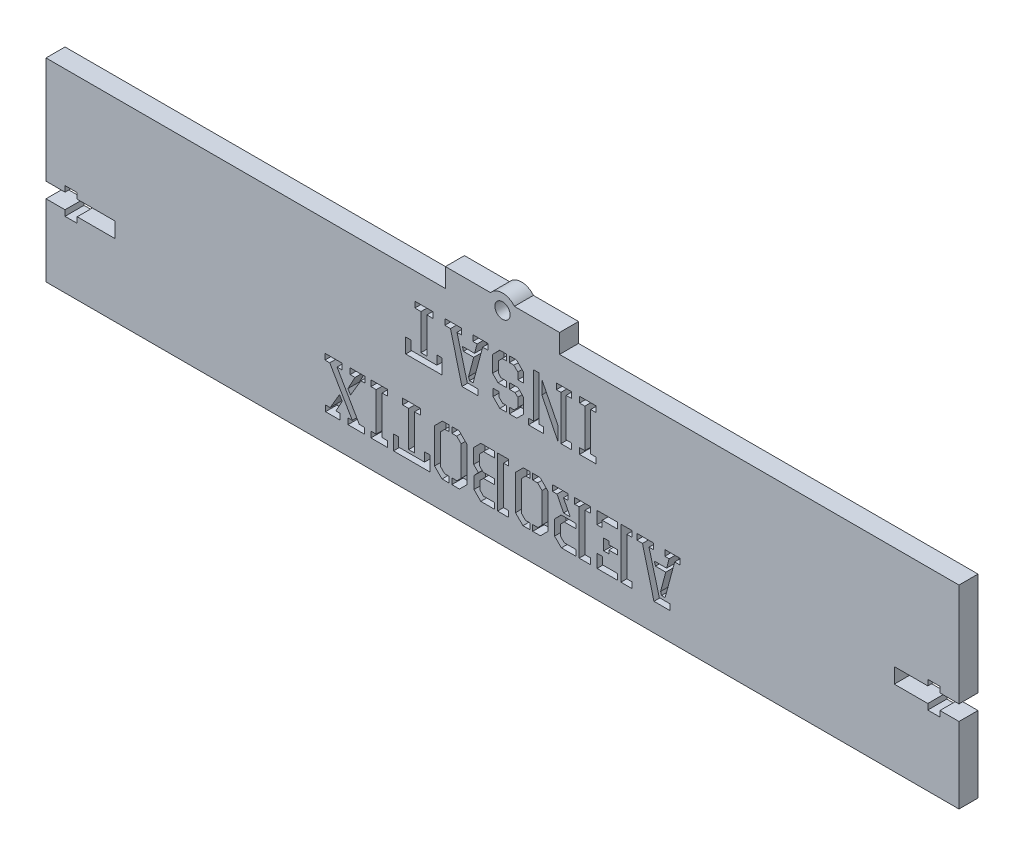
from build123d import *

# Parameters (mm, degrees)
SKETCH1_W           = 240
SKETCH1_H           = 51
BOSS_EXTRUDE1_DEPTH = 5
SKETCH4_W           = 30
SKETCH4_H           = 5
BOSS_EXTRUDE2_DEPTH = 5
SKETCH7_R           = 2
CUT_EXTRUDE2_DEPTH  = 5
SKETCH8_R           = 4
SKETCH8_R_2         = 2
BOSS_EXTRUDE4_DEPTH = 5
CUT_EXTRUDE3_DEPTH  = 3
CUT_EXTRUDE4_DEPTH  = 10
CUT_EXTRUDE5_DEPTH  = 10


with BuildPart() as part:
    # Sketch1 → Boss-Extrude1 (new body)
    with BuildSketch(Plane.XY):
        Rectangle(SKETCH1_W, SKETCH1_H)
    extrude(amount=BOSS_EXTRUDE1_DEPTH)

    # Sketch4 → Boss-Extrude2 (add)
    with BuildSketch(Plane.XY.offset(5)):
        with Locations((0, 28)):
            Rectangle(SKETCH4_W, SKETCH4_H)
    extrude(amount=-BOSS_EXTRUDE2_DEPTH)

    # Sketch7 → Cut-Extrude2 (cut)
    with BuildSketch(Plane.XY.offset(5)):
        with Locations((0, 28)):
            Circle(SKETCH7_R)
    extrude(amount=-CUT_EXTRUDE2_DEPTH, mode=Mode.SUBTRACT)

    # Sketch8 → Boss-Extrude4 (add)
    with BuildSketch(Plane.XY.offset(5)):
        with Locations((0, 28)):
            Circle(SKETCH8_R)
        with Locations((0, 28)):
            Circle(SKETCH8_R_2, mode=Mode.SUBTRACT)
    extrude(amount=-BOSS_EXTRUDE4_DEPTH)

    # Sketch9 → Cut-Extrude3 (cut)
    with BuildSketch(Plane.XY.offset(5)):
        Polygon((-43.493968571, -6.617965842), (-42.175825537, -6.617965842), (-42.175825537, -5.070567123), (-46.676342467, -5.070567123), (-46.676342467, -6.617965842), (-45.414691277, -6.617965842), (-39.483047624, -16.752332411), (-40.612884511, -16.752332411), (-40.612884511, -18.29973379), (-36.263012499, -18.29973379), (-36.263012499, -16.752332411), (-37.637647377, -16.752332411), align=None)
        Polygon((-36.11236758, -6.617965842), (-36.11236758, -5.070567123), (-40.047966068, -5.070567123), (-40.047966068, -6.617965842), (-38.767484263, -6.617965842), (-40.631715125, -10.092278118), (-39.953812994, -11.243983845), (-37.223373852, -6.617965842), align=None)
        Polygon((-46.525697549, -18.29973379), (-42.721913365, -18.29973379), (-42.721913365, -16.752332411), (-43.776427792, -16.752332411), (-42.138164307, -13.758541348), (-42.834897054, -12.549250335), (-45.301707589, -16.752332411), (-46.525697549, -16.752332411), align=None)
        Polygon((-34.578324285, -18.29973379), (-30.281653149, -18.29973379), (-30.281653149, -16.752332411), (-31.656288028, -16.752332411), (-31.656288028, -6.617965842), (-30.281653149, -6.617965842), (-30.281653149, -5.070567123), (-34.578324285, -5.070567123), (-34.578324285, -6.617965842), (-33.203689407, -6.617965842), (-33.203689407, -16.752332411), (-34.578324285, -16.752332411), align=None)
        Polygon((-21.515198519, -6.617965842), (-21.515198519, -5.070567123), (-26.257914189, -5.070567123), (-26.257914189, -6.617965842), (-24.660304932, -6.617965842), (-24.660304932, -15.991270155), (-23.112903553, -15.991270155), (-23.112903553, -6.617965842), align=None)
        Polygon((-28.670462331, -18.298086976), (-19.102743493, -18.298086976), (-19.102743493, -14.410001338), (-20.475790087, -14.410001338), (-20.475790087, -16.753976565), (-27.297415737, -16.753976565), (-27.297415737, -14.410001338), (-28.670462331, -14.410001338), align=None)
        Polygon((-9.338875522, -16.330684138), (-9.338875522, -7.136233419), (-11.400378224, -5.070567123), (-13.32349799, -5.070567123), (-13.32349799, -6.617965842), (-12.047765076, -6.617965842), (-10.886276901, -7.788866664), (-10.886276901, -15.658855798), (-11.971601917, -16.752332411), (-13.32349799, -16.752332411), (-13.32349799, -18.29973379), (-11.305174276, -18.29973379), align=None)
        Polygon((-15.227576966, -16.752332411), (-16.313064269, -15.658855798), (-16.313064269, -7.788866664), (-15.151413807, -6.617965842), (-14.085129581, -6.617965842), (-14.085129581, -5.070567123), (-15.798800659, -5.070567123), (-17.860465649, -7.136233419), (-17.860465649, -16.330684138), (-15.894004608, -18.29973379), (-14.085129581, -18.29973379), (-14.085129581, -16.752332411), align=None)
        Polygon((-5.011321965, -16.752332411), (-5.968682339, -15.763666606), (-5.968682339, -13.689580008), (-5.011321965, -12.720380664), (-2.062652014, -12.720380664), (-2.062652014, -11.34733673), (-5.068763588, -11.34733673), (-6.026131943, -10.377943173), (-6.026131943, -7.66455747), (-5.011321965, -6.617965842), (-2.062652014, -6.617965842), (-2.062652014, -5.070567123), (-5.681474227, -5.070567123), (-7.573533322, -6.966829718), (-7.573533322, -10.823713682), (-6.346263035, -12.088086504), (-7.484506921, -13.30190027), (-7.484506921, -16.500258108), (-5.700621434, -18.29973379), (-2.062652014, -18.29973379), (-2.062652014, -16.752332411), align=None)
        Polygon((1.645475946, -16.752332411), (0.250637664, -16.752332411), (0.250637664, -6.617965842), (1.645475946, -6.617965842), (1.645475946, -5.070567123), (-1.296763715, -5.070567123), (-1.296763715, -18.29973379), (1.645475946, -18.29973379), align=None)
        Polygon((11.932408273, -16.330684138), (11.932408273, -7.136233419), (9.87090557, -5.070567123), (7.947785804, -5.070567123), (7.947785804, -6.617965842), (9.223518718, -6.617965842), (10.385006894, -7.788866664), (10.385006894, -15.658855798), (9.299681877, -16.752332411), (7.947785804, -16.752332411), (7.947785804, -18.29973379), (9.966109519, -18.29973379), align=None)
        Polygon((6.043706828, -16.752332411), (4.958219525, -15.658855798), (4.958219525, -7.788866664), (6.119869987, -6.617965842), (7.186154214, -6.617965842), (7.186154214, -5.070567123), (5.472483136, -5.070567123), (3.410818146, -7.136233419), (3.410818146, -16.330684138), (5.377279187, -18.29973379), (7.186154214, -18.29973379), (7.186154214, -16.752332411), align=None)
        Polygon((23.091114525, -16.752332411), (21.696276244, -16.752332411), (21.696276244, -6.617965842), (23.091114525, -6.617965842), (23.091114525, -5.070567123), (18.971157988, -5.070567123), (18.971157988, -6.617965842), (20.148874865, -6.617965842), (20.148874865, -18.29973379), (23.091114525, -18.29973379), align=None)
        Polygon((16.210280719, -16.752332411), (15.245151852, -15.762966909), (15.245151852, -13.012382894), (16.210280719, -12.022964183), (19.376601503, -12.022964183), (19.376601503, -10.824272375), (15.418700523, -10.824272375), (13.697750473, -12.596827035), (13.697750473, -16.514925129), (15.476621025, -18.29973379), (19.376601503, -18.29973379), (19.376601503, -16.752332411), align=None)
        Polygon((16.017212378, -6.617965842), (17.175622421, -6.617965842), (17.175622421, -5.070567123), (13.151662644, -5.070567123), (13.151662644, -6.617965842), (14.327530514, -6.617965842), (16.055826046, -10.066442557), (17.812747945, -10.066442557), align=None)
        Polygon((34.075465993, -16.752332411), (32.680627712, -16.752332411), (32.680627712, -6.617965842), (34.075465993, -6.617965842), (34.075465993, -5.070567123), (31.133226332, -5.070567123), (31.133226332, -18.283388029), (34.075465993, -18.283388029), align=None)
        Polygon((24.856456726, -18.29973379), (30.239660719, -18.29973379), (30.239660719, -16.752332411), (26.22950332, -16.752332411), (26.22950332, -14.850775535), (24.856456726, -14.850775535), align=None)
        Polygon((24.837626111, -5.070567123), (24.837626111, -8.361513694), (26.210693988, -8.361513694), (26.210693988, -6.642867588), (30.239660719, -6.642867588), (30.239660719, -5.070567123), align=None)
        Polygon((27.95670275, -11.34733673), (27.95670275, -10.475562804), (26.616350339, -10.475562804), (26.616350339, -13.417799804), (27.95670275, -13.417799804), (27.95670275, -12.546028539), (30.239660719, -12.546028539), (30.239660719, -11.34733673), align=None)
        Polygon((44.032208093, -16.752332411), (41.226446492, -16.752332411), (38.514837965, -6.617965842), (39.68233608, -6.617965842), (39.68233608, -5.070567123), (35.313633453, -5.070567123), (35.313633453, -6.617965842), (36.80125202, -6.617965842), (39.814150384, -18.29973379), (44.032208093, -18.29973379), align=None)
        Polygon((45.256198053, -6.617965842), (46.70615539, -6.617965842), (46.70615539, -5.070567123), (42.676403829, -5.070567123), (42.676403829, -6.617965842), (43.806240715, -6.617965842), (43.147169198, -9.084465105), (39.927134072, -9.084465105), (40.209593294, -10.101318303), (42.921201821, -10.101318303), (41.565397557, -15.180263405), (41.791364935, -15.98522829), (42.751726288, -15.98522829), align=None)
        Polygon((-18.289634993, 17.048156234), (-18.289634993, 18.595554953), (-23.032350663, 18.595554953), (-23.032350663, 17.048156234), (-21.434741406, 17.048156234), (-21.434741406, 7.674851921), (-19.887340027, 7.674851921), (-19.887340027, 17.048156234), align=None)
        Polygon((-25.444898805, 5.3680351), (-15.877179967, 5.3680351), (-15.877179967, 9.256120738), (-17.250226561, 9.256120738), (-17.250226561, 6.912145511), (-24.071852211, 6.912145511), (-24.071852211, 9.256120738), (-25.444898805, 9.256120738), align=None)
        Polygon((-6.443502223, 6.913789665), (-9.249263824, 6.913789665), (-11.960872351, 17.048156234), (-10.793374235, 17.048156234), (-10.793374235, 18.595554953), (-15.162076862, 18.595554953), (-15.162076862, 17.048156234), (-13.674458295, 17.048156234), (-10.661559932, 5.366388286), (-6.443502223, 5.366388286), align=None)
        Polygon((-5.219512263, 17.048156234), (-3.769554926, 17.048156234), (-3.769554926, 18.595554953), (-7.799306487, 18.595554953), (-7.799306487, 17.048156234), (-6.6694696, 17.048156234), (-7.328541117, 14.581656971), (-10.548576243, 14.581656971), (-10.266117022, 13.564803773), (-7.554508495, 13.564803773), (-8.910312758, 8.485858671), (-8.684345381, 7.680893787), (-7.723984028, 7.680893787), align=None)
        Polygon((-0.382255095, 12.48208067), (-1.057023225, 13.198154836), (-1.057023225, 16.003432237), (-0.063717607, 17.048156234), (1.060532349, 17.048156234), (1.060532349, 18.595554953), (-0.738267581, 18.595554953), (-2.604421943, 16.699914902), (-2.604421943, 12.425588826), (-1.18151865, 10.956800874), (1.060532349, 10.956800874), (1.060532349, 12.48208067), align=None)
        Polygon((5.568458613, 7.163019955), (5.568458613, 10.975631488), (4.111060017, 12.48208067), (1.81003232, 12.48208067), (1.81003232, 10.956800874), (3.309032261, 10.956800874), (4.021057234, 10.267022525), (4.021057234, 7.891119323), (3.065444771, 6.913789665), (1.81003232, 6.913789665), (1.81003232, 5.366388286), (3.777469743, 5.366388286), align=None)
        Polygon((4.021057234, 16.003432237), (4.021057234, 14.223532093), (5.568458613, 14.223532093), (5.568458613, 16.699914902), (3.683782247, 18.595554953), (1.81003232, 18.595554953), (1.81003232, 17.048156234), (3.009232273, 17.048156234), align=None)
        Polygon((-0.719530082, 5.366388286), (1.060532349, 5.366388286), (1.060532349, 6.913789665), (0.01123239, 6.913789665), (-0.944380073, 7.891119323), (-0.944380073, 9.059910414), (-2.479828082, 9.059910414), (-2.479828082, 7.163019955), align=None)
        Polygon((18.122003147, 6.913789665), (16.727164866, 6.913789665), (16.727164866, 17.048156234), (18.122003147, 17.048156234), (18.122003147, 18.595554953), (14.149352672, 18.595554953), (14.149352672, 17.048156234), (15.354118272, 17.048156234), (15.354118272, 5.366388286), (18.122003147, 5.366388286), align=None)
        Polygon((6.812109246, 5.366388286), (10.783658298, 5.366388286), (10.783658298, 6.913789665), (9.578621333, 6.913789665), (9.578621333, 18.595554953), (8.205574739, 18.595554953), (8.205574739, 6.913789665), (6.812109246, 6.913789665), align=None)
        Polygon((14.589187732, 9.087068215), (10.343823238, 17.498007862), (10.343823238, 13.95217756), (14.589187732, 5.437629626), align=None)
        Polygon((20.256255661, 5.366388286), (24.552926796, 5.366388286), (24.552926796, 6.913789665), (23.178291918, 6.913789665), (23.178291918, 17.048156234), (24.552926796, 17.048156234), (24.552926796, 18.595554953), (20.256255661, 18.595554953), (20.256255661, 17.048156234), (21.630890539, 17.048156234), (21.630890539, 6.913789665), (20.256255661, 6.913789665), align=None)
    extrude(amount=-CUT_EXTRUDE3_DEPTH, mode=Mode.SUBTRACT)

    # Sketch10 → Cut-Extrude4 (cut)
    with BuildSketch(Plane.XY.offset(5)):
        Polygon((-120, -6.562158061), (-115, -6.562158061), (-115, -8.062158061), (-111.8, -8.062158061), (-111.8, -6.562158061), (-101.8, -6.562158061), (-101.8, -2.562158061), (-111.8, -2.562158061), (-111.8, -1.062158061), (-115, -1.062158061), (-115, -2.562158061), (-120, -2.562158061), align=None)
    extrude(amount=-CUT_EXTRUDE4_DEPTH, mode=Mode.SUBTRACT)

    # Sketch12 → Cut-Extrude5 (cut)
    with BuildSketch(Plane.XY.offset(5)):
        Polygon((120, -1.562158061), (120, -5.562158061), (115, -5.562158061), (115, -7.062158061), (111.8, -7.062158061), (111.8, -5.562158061), (103, -5.562158061), (103, -1.562158061), (111.8, -1.562158061), (111.8, -0.062158061), (115, -0.062158061), (115, -1.562158061), align=None)
    extrude(amount=-CUT_EXTRUDE5_DEPTH, mode=Mode.SUBTRACT)


solid = part.part
